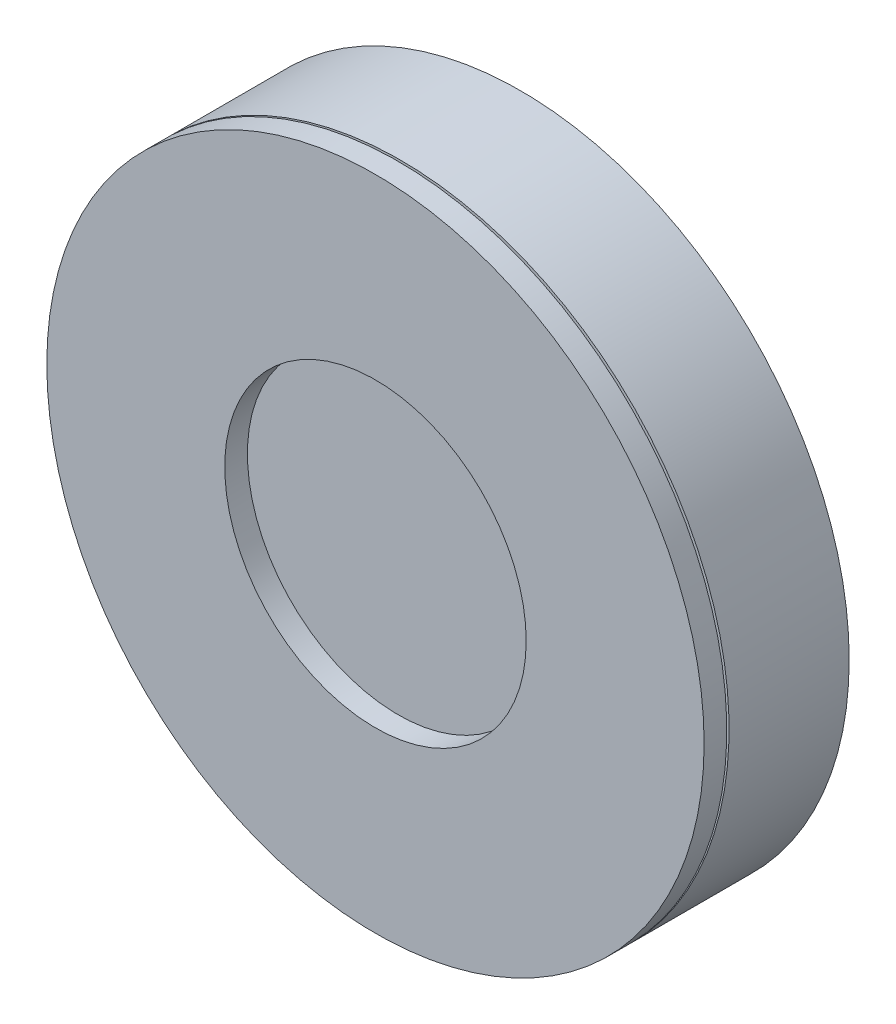
from build123d import *

# Parameters (mm, degrees)
SKIZZE2_R         = 72.5
BASE_DEPTH        = 32
SKIZZE3_W         = 1
SKIZZE3_H         = 0.5
SKIZZE4_R         = 33.25
LIDAR_SPACE_DEPTH = 5


with BuildPart() as part:
    # Skizze2 → Base (new body)
    with BuildSketch(Plane.XY):
        Circle(SKIZZE2_R)
    extrude(amount=BASE_DEPTH)

    # Skizze3 → Cover Seam (revolve, cut)
    with BuildSketch(Plane(origin=(0, 0, 0), x_dir=(1, 0, 0), z_dir=(0, 1, 0)), mode=Mode.PRIVATE) as cover_seam_sk:
        with Locations((72, -26.75)):
            Rectangle(SKIZZE3_W, SKIZZE3_H)
    revolve(cover_seam_sk.sketch.rotate(Axis((0, 0, 0), (0, 0, 1)), 180), axis=Axis((0, 0, 0), (0, 0, 1)), mode=Mode.SUBTRACT)

    # Skizze4 → Lidar Space (cut)
    with BuildSketch(Plane.XY.offset(32)):
        Circle(SKIZZE4_R)
    extrude(amount=-LIDAR_SPACE_DEPTH, mode=Mode.SUBTRACT)


solid = part.part
